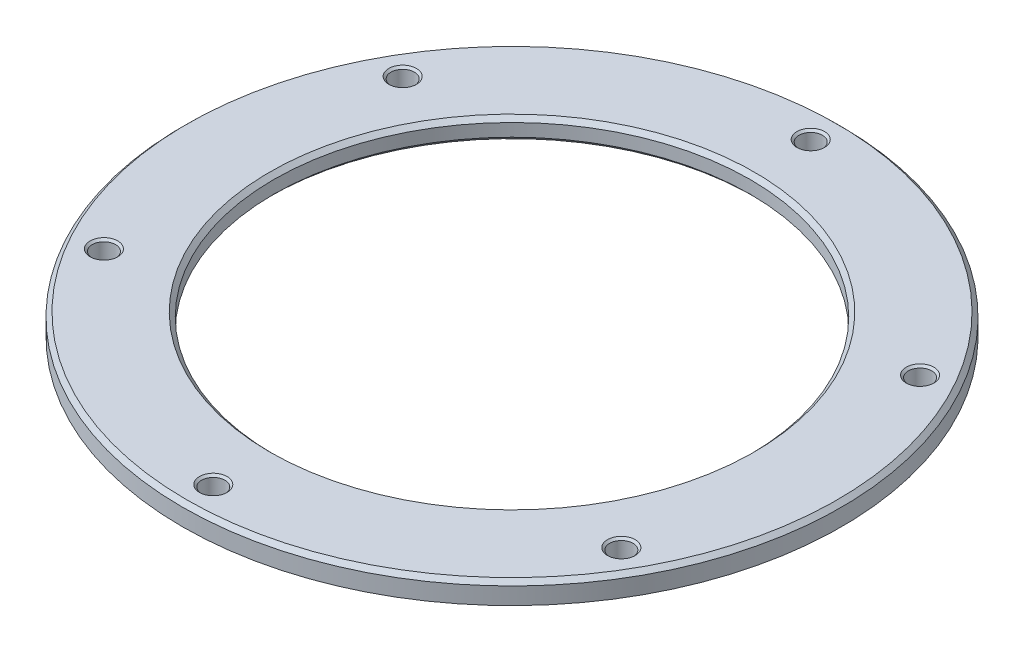
from build123d import *

# Parameters (mm, degrees)
SKETCH1_R                    = 77.5
SKETCH1_R_2                  = 56
BOSS_EXTRUDE1_DEPTH          = 5
SKETCH2_R                    = 2.75
CUT_EXTRUDE2_DEPTH           = 110.715541287
CHAMFER1_SIZE                = 0.5
CIRPATTERN1_COUNT            = 6
CHAMFER1_OF_CIRPATTERN1_SIZE = 0.5
CHAMFER2_SIZE                = 1


with BuildPart() as part:
    # Sketch1 → Boss-Extrude1 (new body)
    with BuildSketch(Plane(origin=(0, 0, 0), x_dir=(1, 0, 0), z_dir=(0, 1, 0))):
        with Locations(Location((0, 0, 0), (0, 0, 270))):
            Circle(SKETCH1_R)
        with Locations(Location((0, 0, 0), (0, 0, 270))):
            Circle(SKETCH1_R_2, mode=Mode.SUBTRACT)
    extrude(amount=BOSS_EXTRUDE1_DEPTH)

    # Sketch2 → Cut-Extrude2 (cut, through all)
    with BuildSketch(Plane(origin=(0, 5, 0), x_dir=(1, 0, 0), z_dir=(0, 1, 0))):
        with Locations(Location((0, 70.25, 0), (0, 0, 270))):
            Circle(SKETCH2_R)
    cut_extrude2 = extrude(amount=-CUT_EXTRUDE2_DEPTH, mode=Mode.SUBTRACT)

    # Chamfer1
    chamfer1_edges = [part.edges().sort_by_distance(p)[0] for p in [
        (0, 0, -73),
        (0, 5, -73),
    ]]
    chamfer(chamfer1_edges, length=CHAMFER1_SIZE)

    # CirPattern1: Cut-Extrude2 ×6 about axis
    cirpattern1_axis = Axis((0, 0, 0), (0, 1, 0))
    for i in range(1, CIRPATTERN1_COUNT):
        add(cut_extrude2.rotate(cirpattern1_axis, i * 360 / CIRPATTERN1_COUNT), mode=Mode.SUBTRACT)

    # Chamfer1 of CirPattern1
    chamfer1_of_cirpattern1_edges = [part.edges().sort_by_distance(p)[0] for p in [
        (-63.219854476, 0, -36.5),
        (-63.219854476, 5, -36.5),
        (-63.219854476, 0, 36.5),
        (-63.219854476, 5, 36.5),
        (0, 0, 73),
        (0, 5, 73),
        (63.219854476, 0, 36.5),
        (63.219854476, 5, 36.5),
        (63.219854476, 0, -36.5),
        (63.219854476, 5, -36.5),
    ]]
    chamfer(chamfer1_of_cirpattern1_edges, length=CHAMFER1_OF_CIRPATTERN1_SIZE)

    # Chamfer2
    chamfer2_edges = [part.edges().sort_by_distance(p)[0] for p in [
        (0, 5, -77.5),
        (0, 0, -56),
        (0, 5, -56),
    ]]
    chamfer(chamfer2_edges, length=CHAMFER2_SIZE)


solid = part.part
